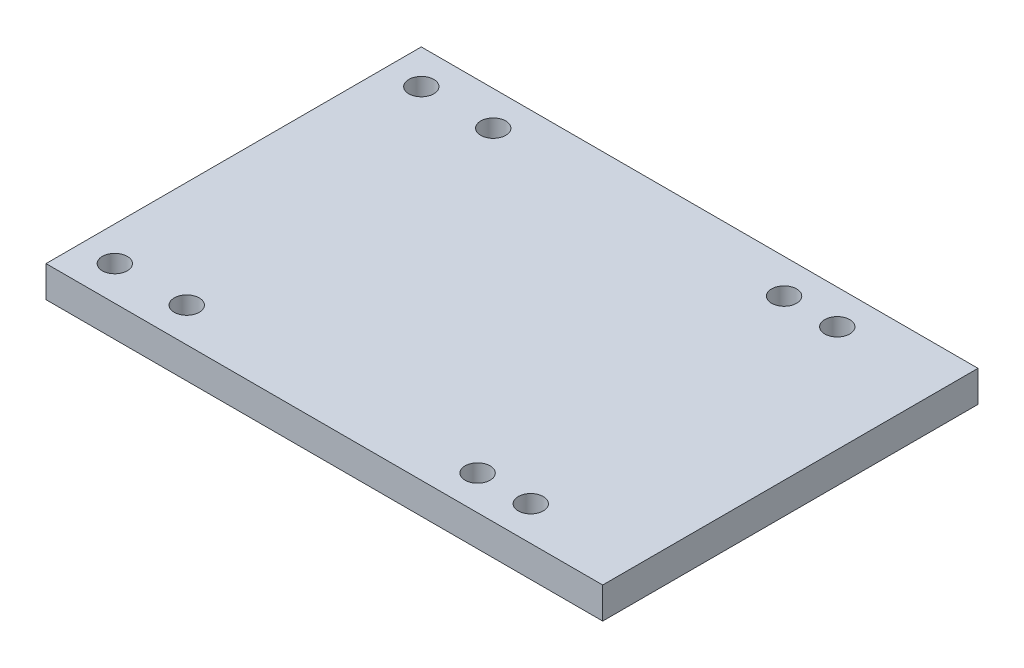
from build123d import *

# Parameters (mm, degrees)
SKETCH_1_W      = 89
SKETCH_1_H      = 60
SKETCH_1_R      = 2
EXTRUDE_1_DEPTH = 5


with BuildPart() as part:
    # 草图1 → 凸台-拉伸1 (new body)
    with BuildSketch(Plane(origin=(0, 0, 0), x_dir=(1, 0, 0), z_dir=(0, 1, 0))):
        with Locations((7.410780669, -8.626394052)):
            Rectangle(SKETCH_1_W, SKETCH_1_H)
        with Locations(Location((-31.589219331, 15.873605948, 0), (0, 0, 270))):
            Circle(SKETCH_1_R, mode=Mode.SUBTRACT)
        with Locations(Location((26.410780669, 15.873605948, 0), (0, 0, 270))):
            Circle(SKETCH_1_R, mode=Mode.SUBTRACT)
        with Locations(Location((-31.589219331, -33.126394052, 0), (0, 0, 270))):
            Circle(SKETCH_1_R, mode=Mode.SUBTRACT)
        with Locations(Location((26.410780669, -33.126394052, 0), (0, 0, 270))):
            Circle(SKETCH_1_R, mode=Mode.SUBTRACT)
        with Locations(Location((-20.089219331, 15.873605948, 0), (0, 0, 270))):
            Circle(SKETCH_1_R, mode=Mode.SUBTRACT)
        with Locations(Location((34.910780669, 15.873605948, 0), (0, 0, 270))):
            Circle(SKETCH_1_R, mode=Mode.SUBTRACT)
        with Locations(Location((-20.089219331, -33.126394052, 0), (0, 0, 270))):
            Circle(SKETCH_1_R, mode=Mode.SUBTRACT)
        with Locations(Location((34.910780669, -33.126394052, 0), (0, 0, 270))):
            Circle(SKETCH_1_R, mode=Mode.SUBTRACT)
    extrude(amount=EXTRUDE_1_DEPTH)


solid = part.part
